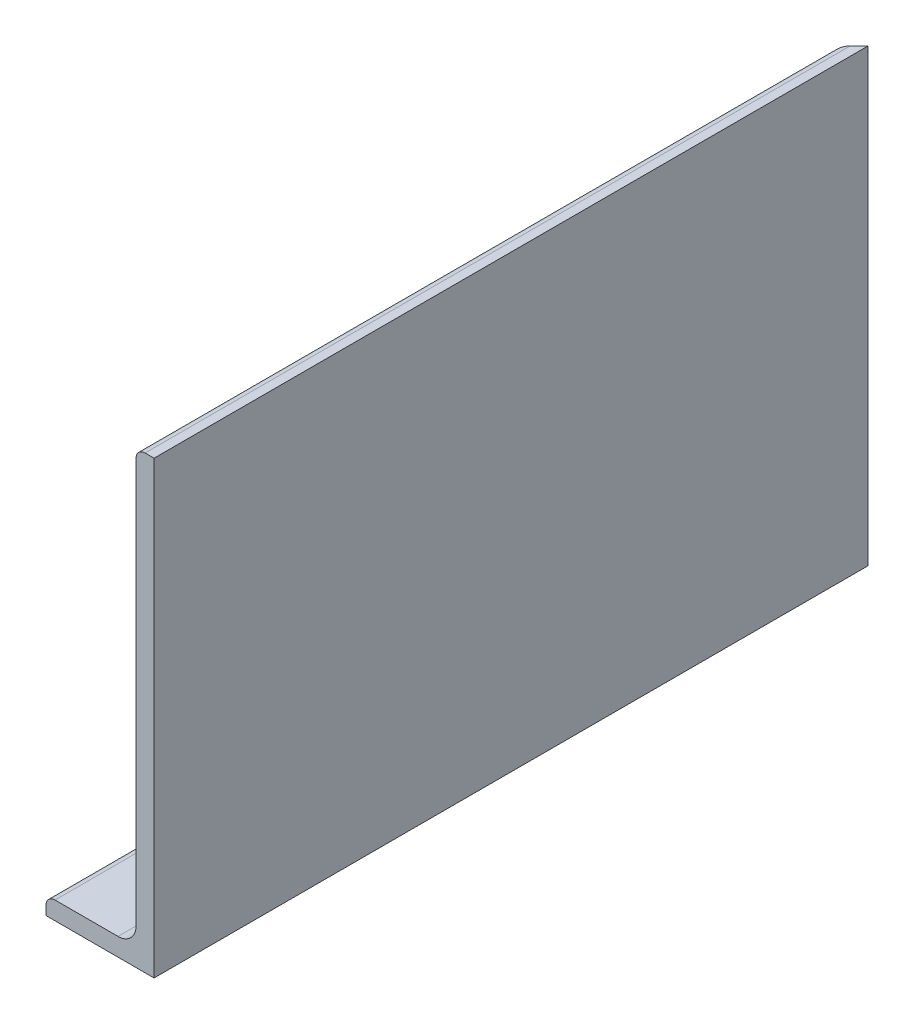
from build123d import *

# Parameters (mm, degrees)
BOSS_EXTRUDE1_DEPTH     = 79.29
FILLET1_R               = 1
FILLET2_R               = 2
SKETCH2_R               = 1.6
CUT_EXTRUDE1_DEPTH      = 308.8152925
CUT_EXTRUDE4_DEPTH      = 308.8152925
CUT_EXTRUDE4_DEPTH_BACK = 308.8152925


with BuildPart() as part:
    # Sketch1 → Boss-Extrude1 (new body)
    with BuildSketch(Plane.XY):
        Polygon((293.529130065, -14.271367807), (293.529130065, -64.271367807), (281.529130065, -64.271367807), (281.529130065, -62.271367807), (291.529130065, -62.271367807), (291.529130065, -14.271367807), align=None)
    extrude(amount=BOSS_EXTRUDE1_DEPTH)

    # Fillet1
    fillet1_edges = [part.edges().sort_by_distance(p)[0] for p in [
        (281.529130065, -62.271367807, 39.645),
        (291.529130065, -14.271367807, 39.645),
    ]]
    fillet(fillet1_edges, radius=FILLET1_R)

    # Fillet2
    fillet2_edges = [part.edges().sort_by_distance(p)[0] for p in [
        (291.529130065, -62.271367807, 39.645),
    ]]
    fillet(fillet2_edges, radius=FILLET2_R)

    # Sketch2 → Cut-Extrude1 (cut, through all)
    with BuildSketch(Plane(origin=(0, -62.271367807, 0), x_dir=(1, 0, 0), z_dir=(0, 1, 0))):
        with Locations(Location((286.029130065, -20, 0), (0, 0, 270))):
            Circle(SKETCH2_R)
        with Locations(Location((286.029130065, -59.29, 0), (0, 0, 270))):
            Circle(SKETCH2_R)
    extrude(amount=-CUT_EXTRUDE1_DEPTH, mode=Mode.SUBTRACT)

    # Sketch3 → Cut-Extrude4 (cut, two sides: drawn at the far end of the back side and taken through both)
    with BuildSketch(Plane(origin=(0, -62.271367807, 0), x_dir=(1, 0, 0), z_dir=(0, 1, 0)).offset(-CUT_EXTRUDE4_DEPTH_BACK)):
        Polygon((293.529130065, 0), (281.33161049, -12.197519575), (281.33161049, 1.118185929), (293.529130065, 1.118185929), align=None)
    extrude(amount=CUT_EXTRUDE4_DEPTH + CUT_EXTRUDE4_DEPTH_BACK, mode=Mode.SUBTRACT)


solid = part.part
